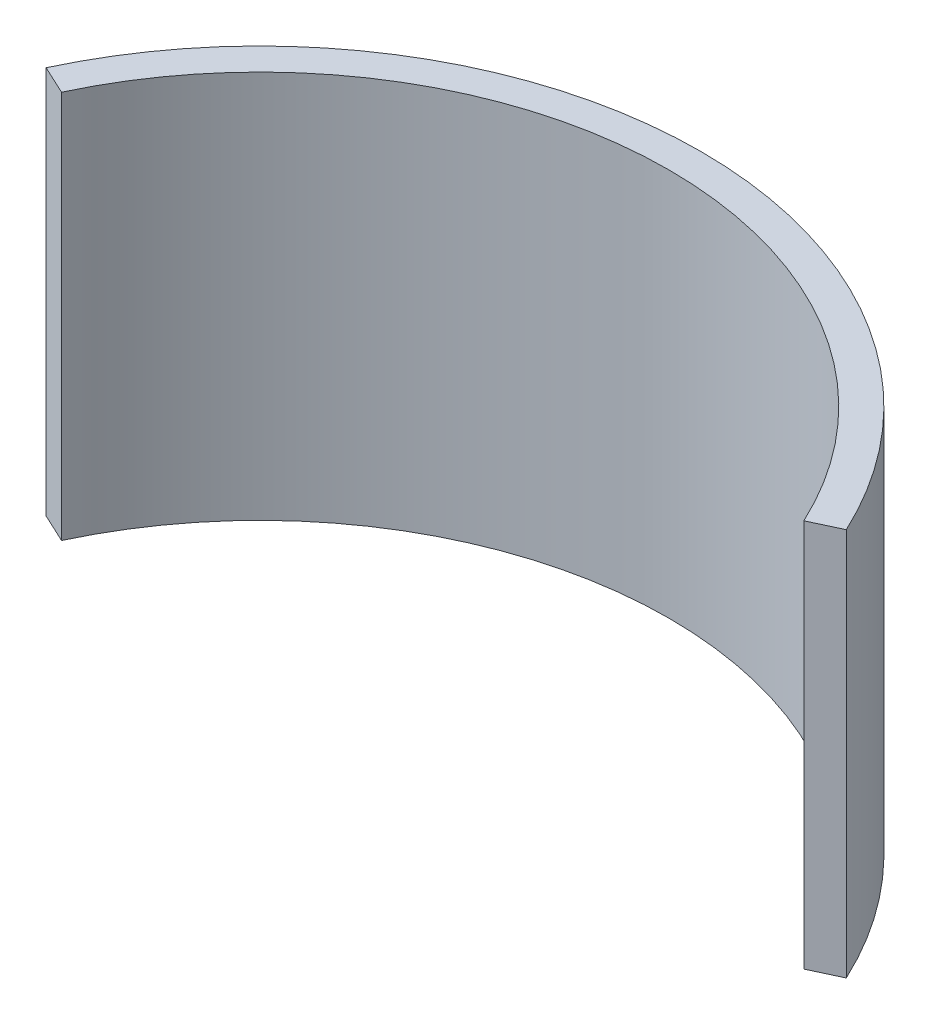
from build123d import *

# Parameters (mm, degrees)
SKETCH2_W                = 3
SKETCH2_H                = 36.5
REVOLVE1_ANGLE           = 65
REVOLVE1_OTHER_WAY_ANGLE = 65


with BuildPart() as part:
    # Sketch2 → Revolve1 (revolve)
    with BuildSketch(Plane(origin=(0, 0, 0), x_dir=(0, 0, -1), z_dir=(1, 0, 0))):
        Rectangle(SKETCH2_W, SKETCH2_H)
    revolve(axis=Axis((0, 51.098803243, 40), (0, -1, 0)), revolution_arc=REVOLVE1_ANGLE)

    # Sketch2 → Revolve1 other way (revolve)
    with BuildSketch(Plane(origin=(0, 0, 0), x_dir=(0, 0, -1), z_dir=(1, 0, 0))):
        Rectangle(SKETCH2_W, SKETCH2_H)
    revolve(axis=Axis((0, 51.098803243, 40), (0, 1, 0)), revolution_arc=REVOLVE1_OTHER_WAY_ANGLE)


solid = part.part
